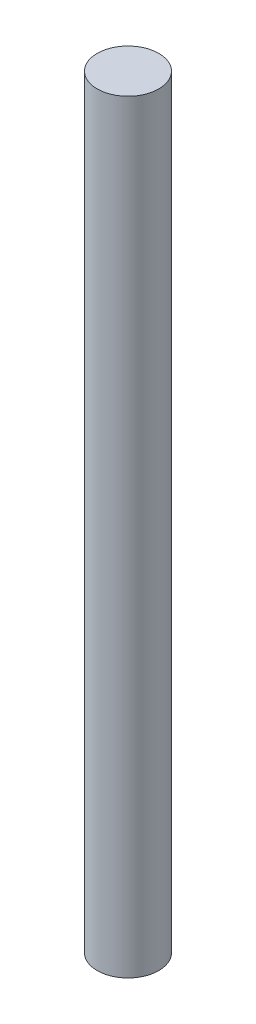
from build123d import *

# Parameters (mm, degrees)
SKETCH1_R           = 2.5
BOSS_EXTRUDE1_DEPTH = 72
CUT_EXTRUDE1_START  = -10
SKETCH3_R           = 2.5
CUT_EXTRUDE1_DEPTH  = 10


with BuildPart() as part:
    # Sketch1 → Boss-Extrude1 (new body)
    with BuildSketch(Plane(origin=(0, 0, 0), x_dir=(1, 0, 0), z_dir=(0, 1, 0))):
        with Locations(Location((0, 0, 0), (0, 0, 270))):
            Circle(SKETCH1_R)
    extrude(amount=BOSS_EXTRUDE1_DEPTH)

    # Sketch3 → Cut-Extrude1 (cut)
    with BuildSketch(Plane(origin=(0, 72, 0), x_dir=(1, 0, 0), z_dir=(0, 1, 0)).offset(CUT_EXTRUDE1_START)):
        with Locations(Location((0, 0, 0), (0, 0, 270))):
            Circle(SKETCH3_R)
    extrude(amount=CUT_EXTRUDE1_DEPTH, mode=Mode.SUBTRACT)


solid = part.part
